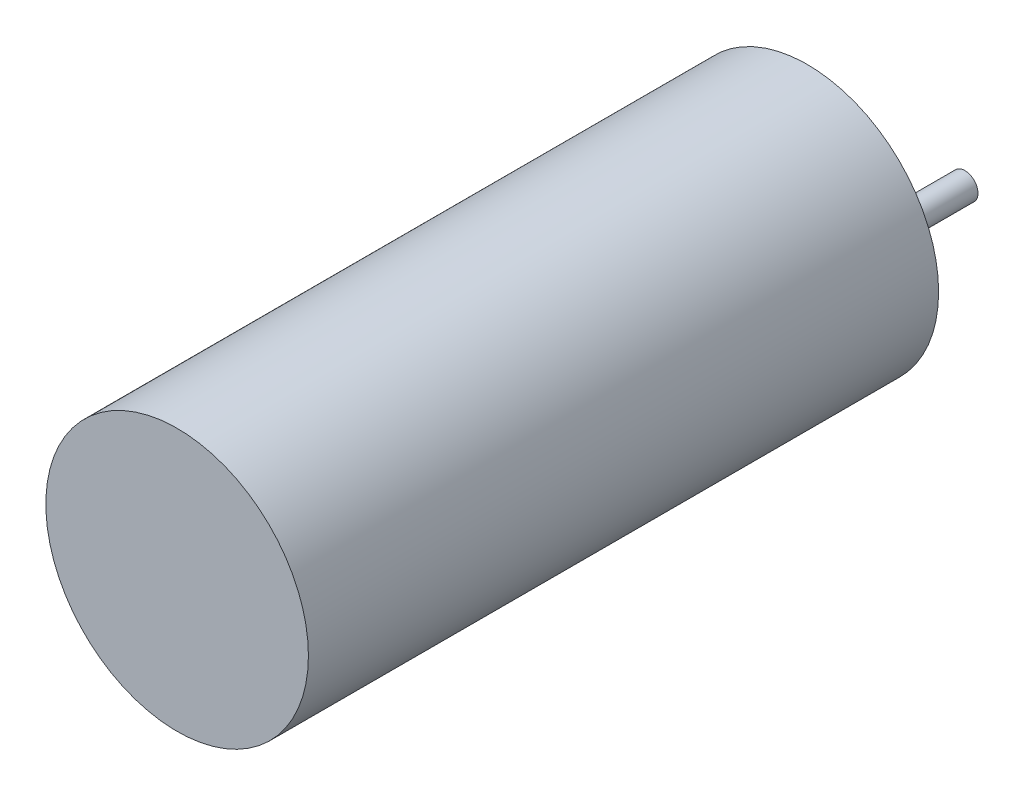
from build123d import *

# Parameters (mm, degrees)
SKETCH1_R           = 2.5
BOSS_EXTRUDE1_DEPTH = 12
SKETCH3_R           = 0.25


with BuildPart() as part:
    # Sketch1 → Boss-Extrude1 (new body)
    with BuildSketch(Plane.XY):
        Circle(SKETCH1_R)
    extrude(amount=BOSS_EXTRUDE1_DEPTH)

    # Sweep1: sweep along a path in Sketch2
    with BuildLine(Plane(origin=(1, 0, 0), x_dir=(0, 0, -1), z_dir=(1, 0, 0))) as sweep1_path:
        Line((0, 0), (2, 0))
    # Sketch3 → Sweep1 (sweep)
    with BuildSketch(Plane(origin=(0, 0, 0), x_dir=(-1, 0, 0), z_dir=(0, 0, -1))):
        with Locations((-1, 0)):
            Circle(SKETCH3_R)
    sweep1 = sweep(path=sweep1_path.line)

    # Mirror1: Sweep1 across plane
    add(sweep1.mirror(Plane(origin=(0, 0, 0), x_dir=(0, 0, 1), z_dir=(1, 0, 0))))


solid = part.part
